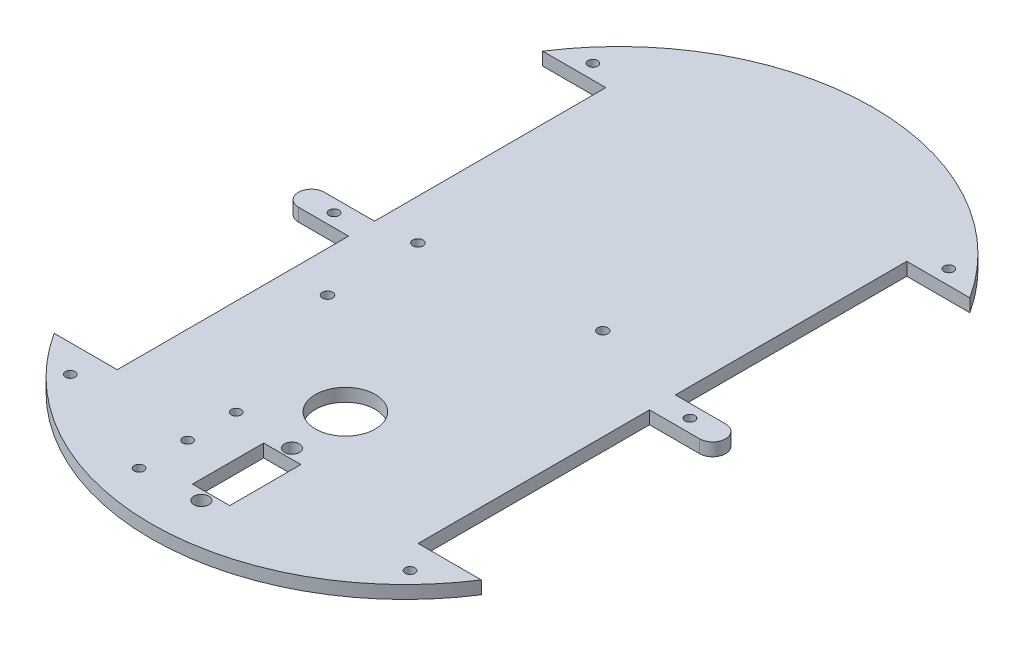
from build123d import *

# Parameters (mm, degrees)
PLATE_DEPTH           = 4
SKETCH2_R             = 1.5
PLATE_MOUNTINGS_DEPTH = 130.631207662
SKETCH3_R             = 1.5
SKETCH3_R_2           = 2.31
SKETCH3_R_3           = 9.25
SKETCH3_W             = 11.5
SKETCH3_H             = 22
CUT_EXTRUDE1_DEPTH    = 130.631207662
SKETCH4_R             = 1.59
CUT_EXTRUDE2_DEPTH    = 130.631207662


with BuildPart() as part:
    # Sketch1 → Plate (new body)
    with BuildSketch(Plane(origin=(0, 0, 0), x_dir=(1, 0, 0), z_dir=(0, 1, 0))):
        with BuildLine():
            Line((62, 4), (46.5, 4))
            Line((46.5, 4), (46.5, 75.5))
            Line((46.5, 75.5), (66, 75.5))
            ThreePointArc((66, 75.5), (0, 111.5), (-66, 75.5))
            Line((-66, 75.5), (-46.5, 75.5))
            Line((-46.5, 75.5), (-46.5, 4))
            Line((-46.5, 4), (-62, 4))
            ThreePointArc((-62, 4), (-66, 0), (-62, -4))
            Line((-62, -4), (-46.5, -4))
            Line((-46.5, -4), (-46.5, -75.5))
            Line((-46.5, -75.5), (-66, -75.5))
            ThreePointArc((-66, -75.5), (0, -111.5), (66, -75.5))
            Line((66, -75.5), (46.5, -75.5))
            Line((46.5, -75.5), (46.5, -4))
            Line((46.5, -4), (62, -4))
            ThreePointArc((62, -4), (66, 0), (62, 4))
        make_face()
    extrude(amount=PLATE_DEPTH)

    # Sketch2 → Plate mountings (cut, through all)
    with BuildSketch(Plane(origin=(0, 4, 0), x_dir=(1, 0, 0), z_dir=(0, 1, 0))):
        with Locations(Location((55, 0, 0), (0, 0, 270))):
            Circle(SKETCH2_R)
        with Locations(Location((55, 80, 0), (0, 0, 270))):
            Circle(SKETCH2_R)
        with Locations(Location((-55, 0, 0), (0, 0, 90))):
            Circle(SKETCH2_R)
        with Locations(Location((-55, 80, 0), (0, 0, 90))):
            Circle(SKETCH2_R)
        with Locations(Location((52.5, -84, 0), (0, 0, 270))):
            Circle(SKETCH2_R)
        with Locations(Location((-52.5, -84, 0), (0, 0, 90))):
            Circle(SKETCH2_R)
    extrude(amount=-PLATE_MOUNTINGS_DEPTH, mode=Mode.SUBTRACT)

    # Sketch3 → Cut-Extrude1 (cut, through all)
    with BuildSketch(Plane(origin=(0, 4, 0), x_dir=(1, 0, 0), z_dir=(0, 1, 0))):
        with Locations(Location((-16.75, -98.5, 0), (0, 0, 270))):
            Circle(SKETCH3_R)
        with Locations(Location((1.5, -69.5, 0), (0, 0, 270))):
            Circle(SKETCH3_R_2)
        with Locations(Location((1.5, -97.5, 0), (0, 0, 90))):
            Circle(SKETCH3_R_2)
        with Locations(Location((-16.75, -83.5, 0), (0, 0, 270))):
            Circle(SKETCH3_R)
        with Locations(Location((-16.75, -68.5, 0), (0, 0, 270))):
            Circle(SKETCH3_R)
        with Locations(Location((0, -51.5, 0), (0, 0, 270))):
            Circle(SKETCH3_R_3)
        with Locations((1.5, -83.5)):
            Rectangle(SKETCH3_W, SKETCH3_H)
    extrude(amount=-CUT_EXTRUDE1_DEPTH, mode=Mode.SUBTRACT)

    # Sketch4 → Cut-Extrude2 (cut, through all)
    with BuildSketch(Plane(origin=(0, 4, 0), x_dir=(1, 0, 0), z_dir=(0, 1, 0))):
        with Locations(Location((18.11, 9.96, 0), (0, 0, 270))):
            Circle(SKETCH4_R)
        with Locations(Location((-33.96, 4.88, 0), (0, 0, 270))):
            Circle(SKETCH4_R)
        with Locations(Location((-33.96, -23.06, 0), (0, 0, 270))):
            Circle(SKETCH4_R)
    extrude(amount=-CUT_EXTRUDE2_DEPTH, mode=Mode.SUBTRACT)


solid = part.part
